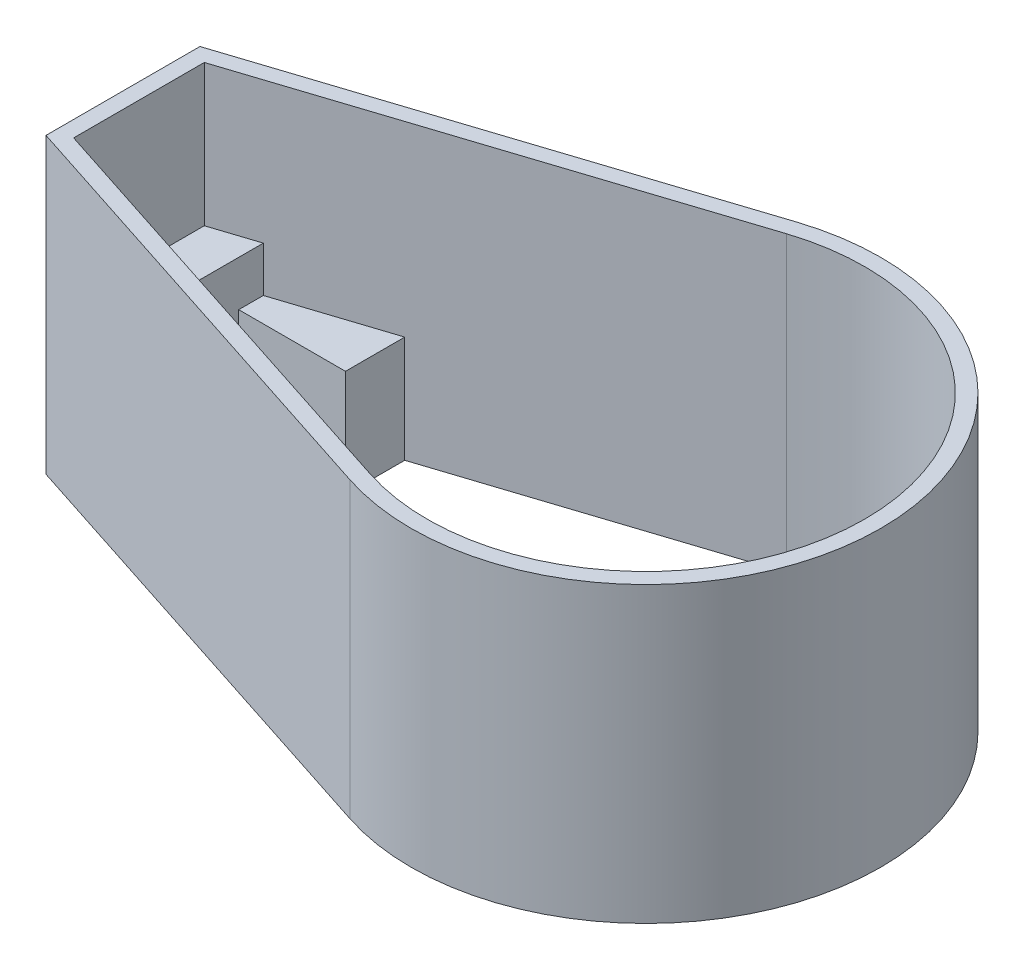
from build123d import *

# Parameters (mm, degrees)
BOSS_EXTRUDE1_DEPTH = 55
BOSS_EXTRUDE2_DEPTH = 28.5
BOSS_EXTRUDE3_DEPTH = 20


with BuildPart() as part:
    # Sketch1 → Boss-Extrude1 (new body)
    with BuildSketch(Plane(origin=(0, 0, 0), x_dir=(1, 0, 0), z_dir=(0, 1, 0))):
        with BuildLine():
            Line((-97.999995759, -14.422208071), (-13.596749299, -41.846487728))
            ThreePointArc((-13.596749299, -41.846487728), (44.00000144, 0), (-13.596749299, 41.846487728))
            Line((-13.596749299, 41.846487728), (-97.999995759, 14.422208071))
            Line((-97.999995759, 14.422208071), (-97.999995759, -14.422208071))
        make_face()
        with BuildLine():
            Line((-94.999995759, -12.242580547), (-12.669698241, -38.993318204))
            ThreePointArc((-12.669698241, -38.993318204), (41.00000144, 0), (-12.669698241, 38.993318204))
            Line((-12.669698241, 38.993318204), (-94.999995759, 12.242580547))
            Line((-94.999995759, 12.242580547), (-94.999995759, -12.242580547))
        make_face(mode=Mode.SUBTRACT)
    extrude(amount=BOSS_EXTRUDE1_DEPTH)

    # Sketch2 → Boss-Extrude2 (add)
    with BuildSketch(Plane.XZ):
        Polygon((-86.653035759, 14.954672498), (-86.653035759, -14.954672498), (-94.999995759, -12.242580547), (-94.999995759, 12.242580547), align=None)
    extrude(amount=-BOSS_EXTRUDE2_DEPTH)

    # Sketch3 → Boss-Extrude3 (add)
    with BuildSketch(Plane.XZ):
        Polygon((-86.653035759, -10.35), (-66.653035759, -10.35), (-66.653035759, -21.453067005), (-86.653035759, -14.954672498), align=None)
        Polygon((-66.653035759, 21.453067005), (-86.653035759, 14.954672498), (-86.653035759, 10.35), (-66.653035759, 10.35), align=None)
    extrude(amount=-BOSS_EXTRUDE3_DEPTH)


solid = part.part
